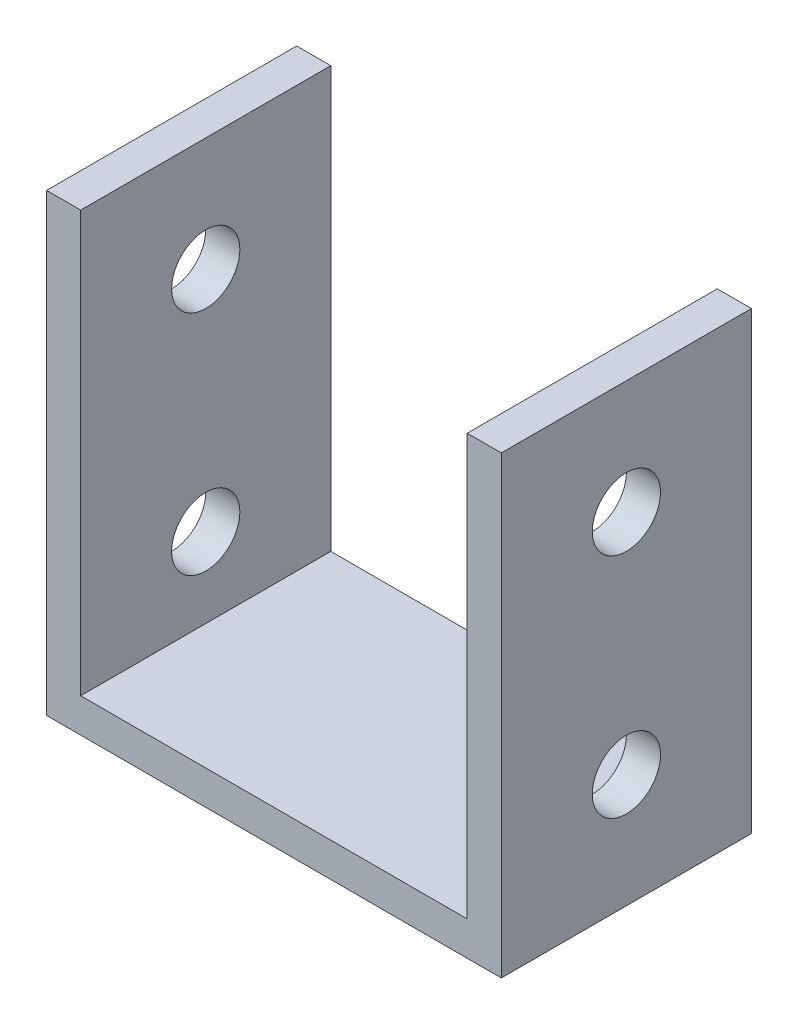
from build123d import *

# Parameters (mm, degrees)
EXTRUSION1_DEPTH = 11
ESQUISSE3_R      = 1.5
EXTRUSION3_DEPTH = 33.050075964


with BuildPart() as part:
    # Esquisse1 → Extrusion1 (new body)
    with BuildSketch(Plane.XY):
        Polygon((-25.613160064, 22.499052632), (-25.613160064, 2.499052632), (-5.613160064, 2.499052632), (-5.613160064, 22.499052632), (-7.113160064, 22.499052632), (-7.113160064, 3.999052632), (-24.113160064, 3.999052632), (-24.113160064, 22.499052632), align=None)
    extrude(amount=EXTRUSION1_DEPTH)

    # Esquisse3 → Extrusion3 (cut, through all)
    with BuildSketch(Plane(origin=(-5.613160064, 0, 0), x_dir=(0, 0, -1), z_dir=(1, 0, 0))):
        with Locations((-5.5, 7.499052632)):
            Circle(ESQUISSE3_R)
        with Locations((-5.5, 17.499052632)):
            Circle(ESQUISSE3_R)
    extrude(amount=-EXTRUSION3_DEPTH, mode=Mode.SUBTRACT)


solid = part.part
